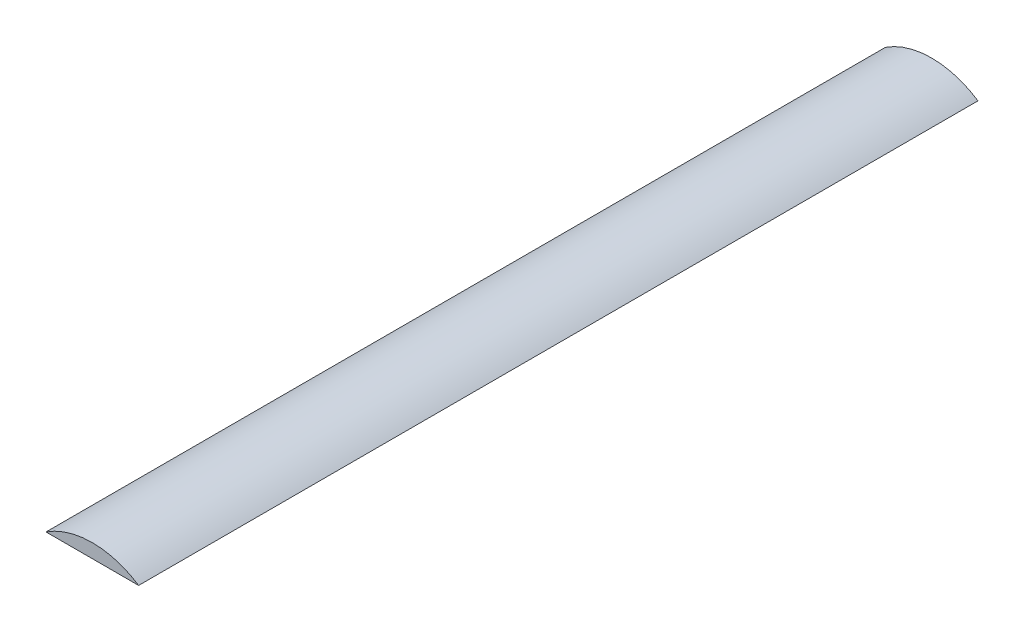
from build123d import *

# Parameters (mm, degrees)
SKETCH3_R               = 1000
BOSS_EXTRUDE2_DEPTH     = 10000
CUT_EXTRUDE1_DEPTH      = 1646
CUT_EXTRUDE1_DEPTH_BACK = 11886
SKETCH4_W               = 2661.896880194
SKETCH4_H               = 1886.780216117


with BuildPart() as part:
    # Sketch3 → Boss-Extrude2 (new body)
    with BuildSketch(Plane.XY):
        Circle(SKETCH3_R)
    extrude(amount=BOSS_EXTRUDE2_DEPTH)

    # Sketch4 → Cut-Extrude1 (cut, two sides: drawn at the far end of the back side and taken through both)
    with BuildSketch(Plane.XY.offset(10000).offset(-CUT_EXTRUDE1_DEPTH_BACK)):
        with Locations((39.928453203, -109.390108059)):
            Rectangle(SKETCH4_W, SKETCH4_H)
    extrude(amount=CUT_EXTRUDE1_DEPTH + CUT_EXTRUDE1_DEPTH_BACK, mode=Mode.SUBTRACT)


solid = part.part
